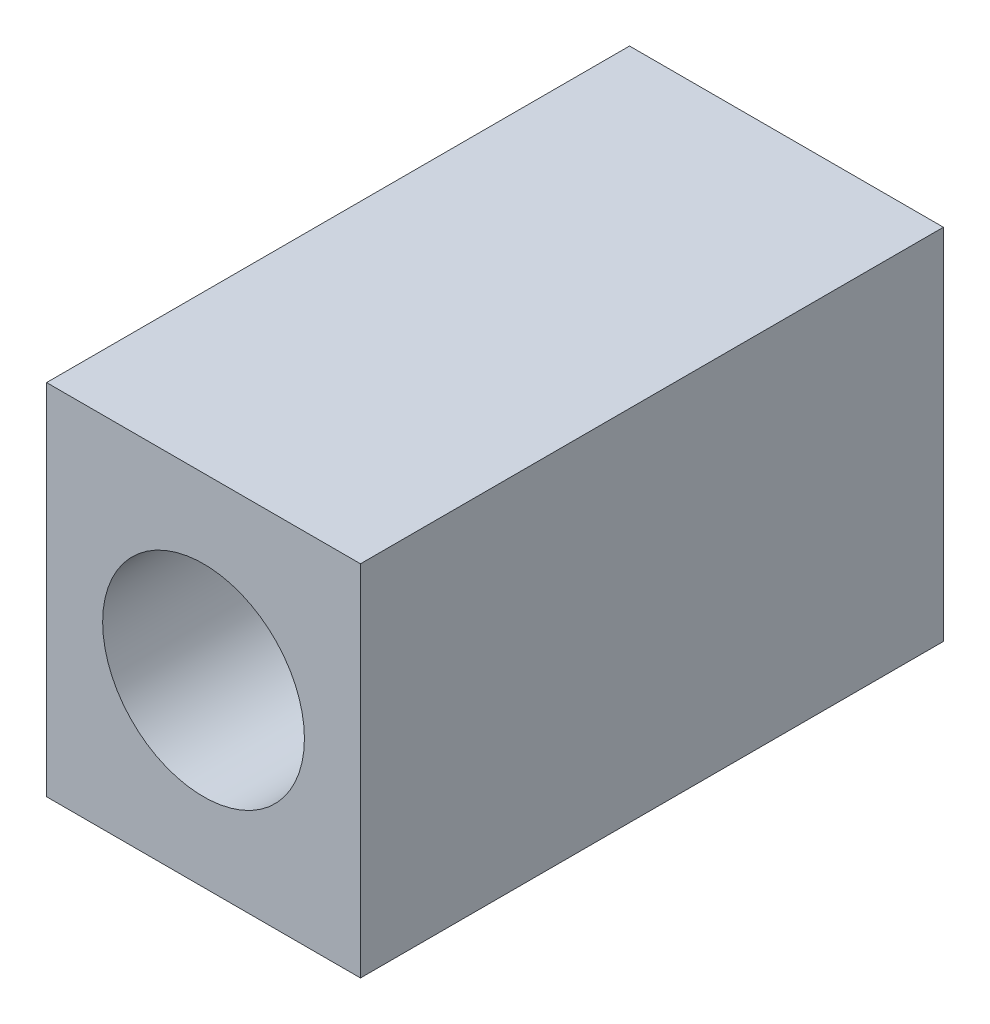
from build123d import *

# Parameters (mm, degrees)
ESQUISSE1_W             = 7
ESQUISSE1_H             = 8
ESQUISSE1_R             = 2.25
BOSS_EXTRU_1_DEPTH      = 13
ESQUISSE2_R             = 1.75
ENL_V_MAT_EXTRU_1_DEPTH = 1


with BuildPart() as part:
    # Esquisse1 → Boss.-Extru.1 (new body)
    with BuildSketch(Plane.XY):
        Rectangle(ESQUISSE1_W, ESQUISSE1_H)
        with Locations(Location((0, 0, 0), (0, 0, 180))):
            Circle(ESQUISSE1_R, mode=Mode.SUBTRACT)
    extrude(amount=BOSS_EXTRU_1_DEPTH)

    # Esquisse2 → Enlèv. mat.-Extru.1 (cut)
    with BuildSketch(Plane.XZ.offset(4)):
        with Locations(Location((0, 4, 0), (0, 0, 270))):
            Circle(ESQUISSE2_R)
    extrude(amount=-ENL_V_MAT_EXTRU_1_DEPTH, mode=Mode.SUBTRACT)


solid = part.part
